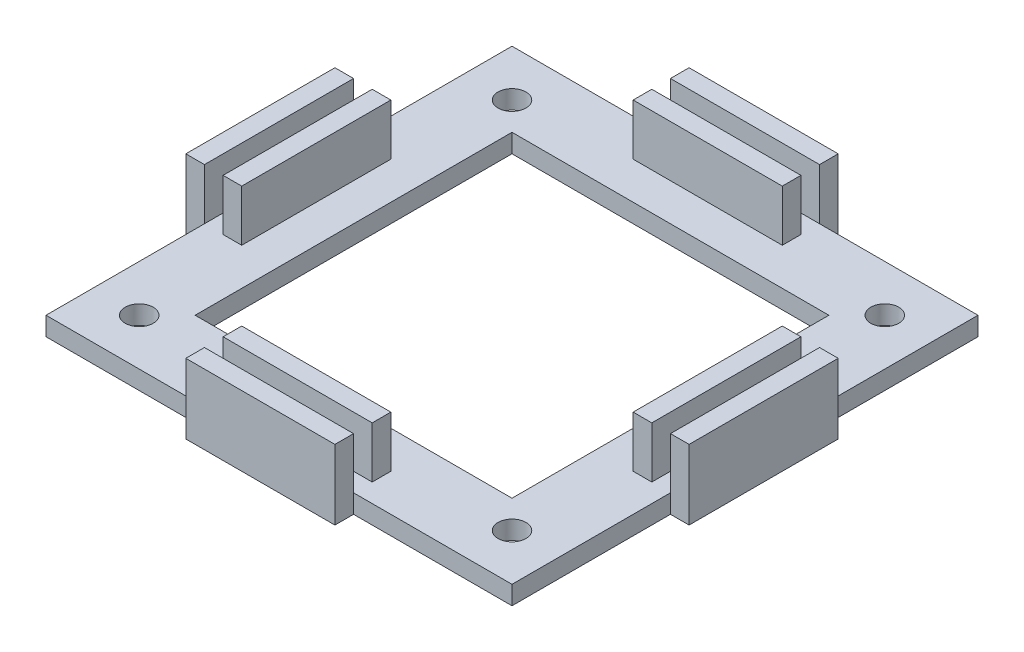
from build123d import *

# Parameters (mm, degrees)
SKETCH1_W           = 50
SKETCH1_H           = 50
SKETCH1_W_2         = 34
SKETCH1_H_2         = 34
BOSS_EXTRUDE1_DEPTH = 2
SKETCH2_R           = 1.5
CUT_EXTRUDE1_DEPTH  = 2
SKETCH7_W           = 16
SKETCH7_H           = 2
SKETCH7_W_2         = 2
SKETCH7_H_2         = 16
BOSS_EXTRUDE4_DEPTH = 7.5


with BuildPart() as part:
    # Sketch1 → Boss-Extrude1 (new body)
    with BuildSketch(Plane(origin=(0, 0, 0), x_dir=(1, 0, 0), z_dir=(0, 1, 0))):
        Rectangle(SKETCH1_W, SKETCH1_H)
        Rectangle(SKETCH1_W_2, SKETCH1_H_2, mode=Mode.SUBTRACT)
    extrude(amount=BOSS_EXTRUDE1_DEPTH)

    # Sketch2 → Cut-Extrude1 (cut)
    with BuildSketch(Plane(origin=(0, 2, 0), x_dir=(1, 0, 0), z_dir=(0, 1, 0))):
        with Locations(Location((-20, 20, 0), (0, 0, 270))):
            Circle(SKETCH2_R)
        with Locations(Location((20, 20, 0), (0, 0, 270))):
            Circle(SKETCH2_R)
        with Locations(Location((20, -20, 0), (0, 0, 270))):
            Circle(SKETCH2_R)
        with Locations(Location((-20, -20, 0), (0, 0, 270))):
            Circle(SKETCH2_R)
    extrude(amount=-CUT_EXTRUDE1_DEPTH, mode=Mode.SUBTRACT)

    # Sketch7 → Boss-Extrude4 (add)
    with BuildSketch(Plane(origin=(0, 0, 0), x_dir=(1, 0, 0), z_dir=(0, 1, 0))):
        with Locations((0, 22)):
            Rectangle(SKETCH7_W, SKETCH7_H)
        with Locations((-26, 0)):
            Rectangle(SKETCH7_W_2, SKETCH7_H_2)
        with Locations((-22, 0)):
            Rectangle(SKETCH7_W_2, SKETCH7_H_2)
        with Locations((0, 26)):
            Rectangle(SKETCH7_W, SKETCH7_H)
        with Locations((22, 0)):
            Rectangle(SKETCH7_W_2, SKETCH7_H_2)
        with Locations((26, 0)):
            Rectangle(SKETCH7_W_2, SKETCH7_H_2)
        with Locations((0, -22)):
            Rectangle(SKETCH7_W, SKETCH7_H)
        with Locations((0, -26)):
            Rectangle(SKETCH7_W, SKETCH7_H)
    extrude(amount=BOSS_EXTRUDE4_DEPTH)


solid = part.part
